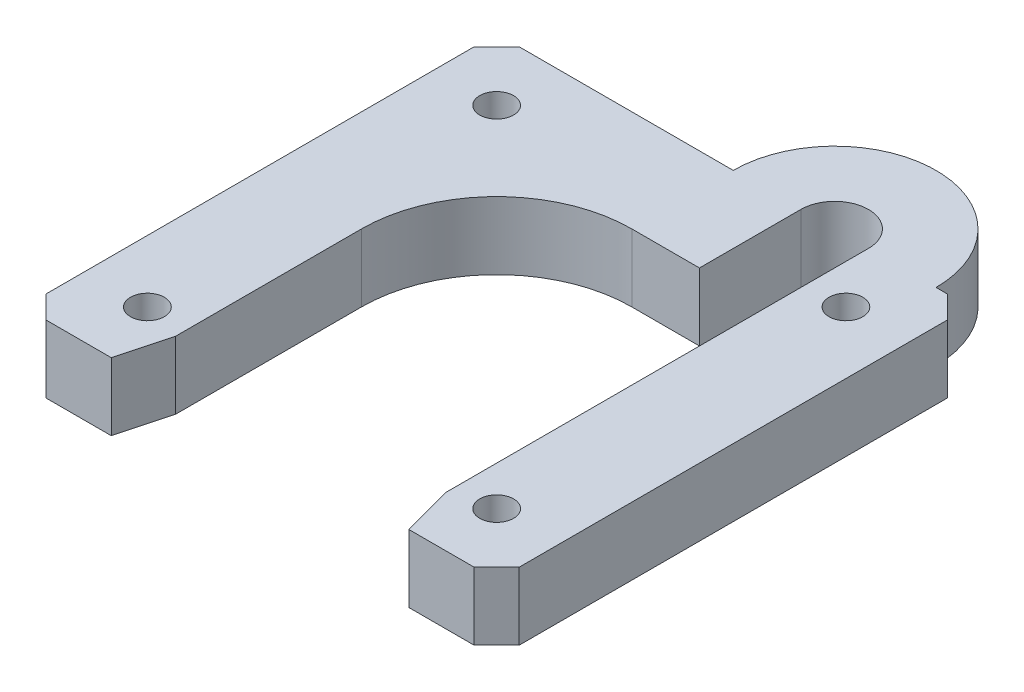
from build123d import *
from OCP.BRepFilletAPI import BRepFilletAPI_MakeChamfer

# Parameters (mm, degrees)
SKETCH1_W           = 42
SKETCH1_H           = 42
SKETCH1_R           = 12
SKETCH1_R_2         = 1.5
BOSS_EXTRUDE1_DEPTH = 6
CHAMFER1_SIZE       = 2
SKETCH2_W           = 24
SKETCH2_H           = 21
CUT_EXTRUDE1_DEPTH  = 31.298514815
CHAMFER2_SIZE       = 4.5
CHAMFER2_SIZE2      = 1.205771366
BOSS_EXTRUDE2_DEPTH = 6
CUT_EXTRUDE2_DEPTH  = 43.107006543


with BuildPart() as part:
    # Sketch1 → Boss-Extrude1 (new body)
    with BuildSketch(Plane(origin=(0, 0, 0), x_dir=(1, 0, 0), z_dir=(0, 1, 0))):
        Rectangle(SKETCH1_W, SKETCH1_H)
        with Locations(Location((0, 0, 0), (0, 0, 270))):
            Circle(SKETCH1_R, mode=Mode.SUBTRACT)
        with Locations(Location((-15.5, 15.5, 0), (0, 0, 270))):
            Circle(SKETCH1_R_2, mode=Mode.SUBTRACT)
        with Locations(Location((15.5, 15.5, 0), (0, 0, 270))):
            Circle(SKETCH1_R_2, mode=Mode.SUBTRACT)
        with Locations(Location((15.5, -15.5, 0), (0, 0, 270))):
            Circle(SKETCH1_R_2, mode=Mode.SUBTRACT)
        with Locations(Location((-15.5, -15.5, 0), (0, 0, 270))):
            Circle(SKETCH1_R_2, mode=Mode.SUBTRACT)
    extrude(amount=BOSS_EXTRUDE1_DEPTH)

    # Chamfer1
    chamfer1_edges = [part.edges().sort_by_distance(p)[0] for p in [
        (21, 3, 21),
        (-21, 3, 21),
        (-21, 3, -21),
        (21, 3, -21),
    ]]
    chamfer(chamfer1_edges, length=CHAMFER1_SIZE)

    # Sketch2 → Cut-Extrude1 (cut, through all)
    with BuildSketch(Plane(origin=(0, 6, 0), x_dir=(1, 0, 0), z_dir=(0, 1, 0))):
        with Locations((0, -10.5)):
            Rectangle(SKETCH2_W, SKETCH2_H)
    extrude(amount=-CUT_EXTRUDE1_DEPTH, mode=Mode.SUBTRACT)

    # Chamfer2: one chamfer whose edges measure the first distance from different faces: ONE call of the kernel's chamfer builder (chamfer() names one face for all edges)
    chamfer2_edges_1 = [part.edges().sort_by_distance(p)[0] for p in [
        (12, 3, 21),
    ]]
    chamfer2_side_1 = [part.faces().sort_by_distance(p)[0] for p in [
        (12, 3, 10.5),
    ]]
    chamfer2_edges_2 = [part.edges().sort_by_distance(p)[0] for p in [
        (-12, 3, 21),
    ]]
    chamfer2_side_2 = [part.faces().sort_by_distance(p)[0] for p in [
        (-12, 3, 10.5),
    ]]
    chamfer2 = BRepFilletAPI_MakeChamfer(part.part.solid().wrapped)
    for e in chamfer2_edges_1:
        chamfer2.Add(CHAMFER2_SIZE, CHAMFER2_SIZE2, e.wrapped, chamfer2_side_1[0].wrapped)  # the first distance lies on this face
    for e in chamfer2_edges_2:
        chamfer2.Add(CHAMFER2_SIZE, CHAMFER2_SIZE2, e.wrapped, chamfer2_side_2[0].wrapped)  # the first distance lies on this face
    add(Compound.cast(chamfer2.Shape()), mode=Mode.REPLACE)

    # Sketch3 → Boss-Extrude2 (add)
    with BuildSketch(Plane(origin=(0, 6, 0), x_dir=(1, 0, 0), z_dir=(0, 1, 0))):
        with BuildLine():
            Line((0, 21), (6, 21))
            ThreePointArc((6, 21), (9, 24), (12, 21))
            Line((12, 21), (18, 21))
            ThreePointArc((18, 21), (9, 30), (0, 21))
        make_face()
    extrude(amount=-BOSS_EXTRUDE2_DEPTH)

    # Sketch4 → Cut-Extrude2 (cut, through all)
    with BuildSketch(Plane(origin=(0, 6, 6), x_dir=(1, 0, 0), z_dir=(0, 1, 0))):
        with BuildLine():
            Line((12, 6), (12, 27))
            ThreePointArc((12, 27), (9, 30), (6, 27))
            Line((6, 27), (6, 18))
            Line((6, 18), (0, 18))
            Line((0, 18), (0, 6))
            Line((0, 6), (12, 6))
        make_face()
    extrude(amount=-CUT_EXTRUDE2_DEPTH, mode=Mode.SUBTRACT)


solid = part.part
